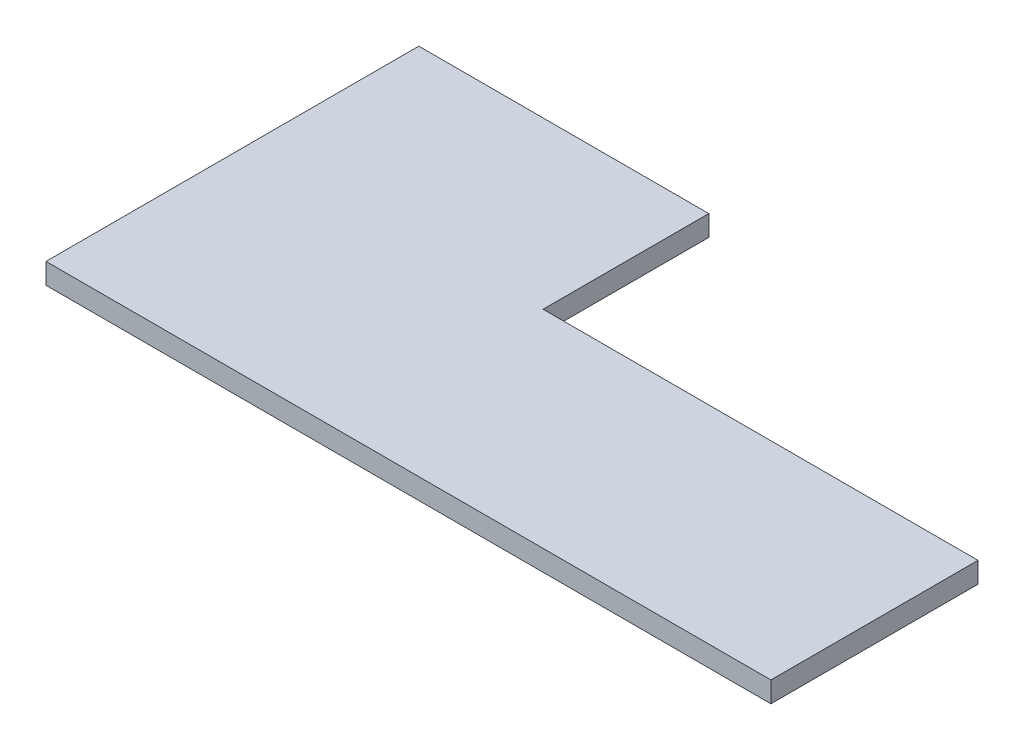
from build123d import *

# Parameters (mm, degrees)
EXTRUDE1_DEPTH = 1


with BuildPart() as part:
    # Sketch1 → Extrude1 (new body)
    with BuildSketch(Plane(origin=(0, 0, 0), x_dir=(1, 0, 0), z_dir=(0, 1, 0))):
        Polygon((0, 18), (0, 0), (35, 0), (35, 10), (14, 10), (14, 18), align=None)
    extrude(amount=EXTRUDE1_DEPTH)


solid = part.part
